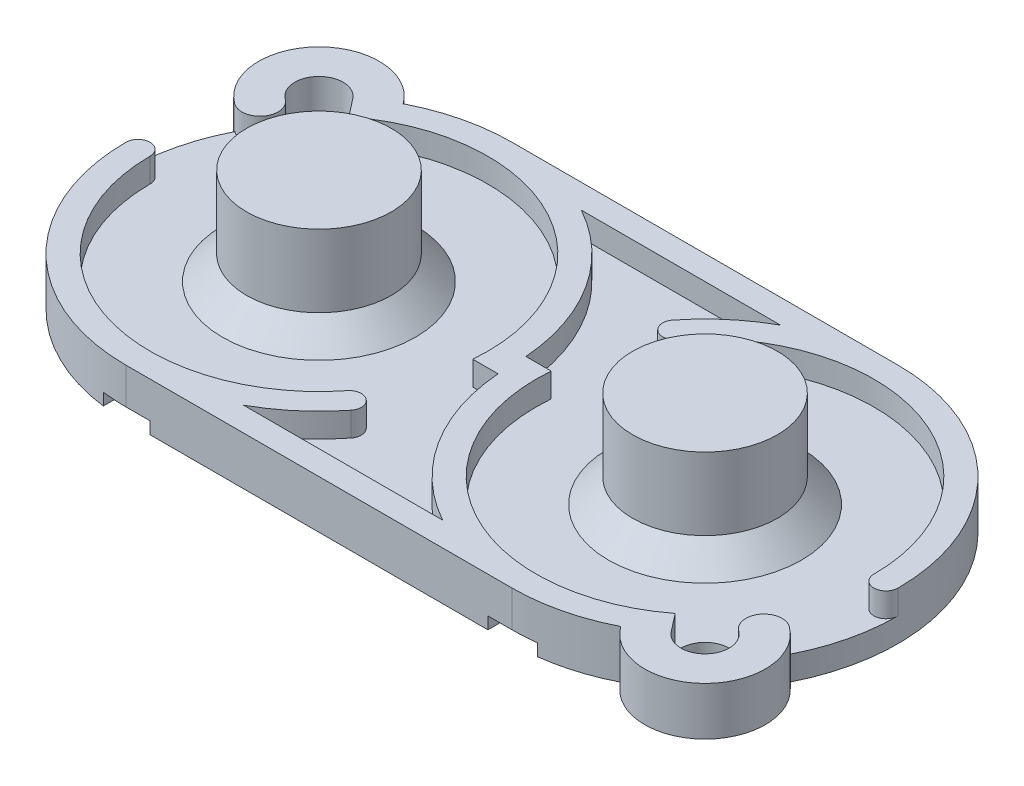
from build123d import *

# Parameters (mm, degrees)
SKETCH1_R            = 1
BASE_EXTRUDE_DEPTH   = 1
BOSS_EXTRUDE7_DEPTH  = 1
CIRPATTERN1_COUNT    = 2
BOSS_EXTRUDE8_DEPTH  = 1
SKETCH10_R           = 3
BOSS_EXTRUDE9_DEPTH  = 4
CHAMFER1_SIZE        = 1
CUT_EXTRUDE1_DEPTH   = 0.5
SKETCH14_R           = 2.5
BOSS_EXTRUDE10_DEPTH = 0.5


with BuildPart() as part:
    # Sketch1 → Base Extrude (new body)
    with BuildSketch(Plane(origin=(0, 0, 0), x_dir=(1, 0, 0), z_dir=(0, 1, 0))):
        with BuildLine():
            Line((0, 8), (16, 8))
            ThreePointArc((16, 8), (22.821901857, 4.178714521), (23.126695088, -3.634586238))
            ThreePointArc((23.126695088, -3.634586238), (23.424621202, -7.424621202), (19.634586238, -7.126695088))
            ThreePointArc((19.634586238, -7.126695088), (17.86901569, -7.778610438), (16, -8))
            Line((16, -8), (0, -8))
            ThreePointArc((0, -8), (-6.821901857, -4.178714521), (-7.126695088, 3.634586238))
            ThreePointArc((-7.126695088, 3.634586238), (-7.424621202, 7.424621202), (-3.634586238, 7.126695088))
            ThreePointArc((-3.634586238, 7.126695088), (-1.86901569, 7.778610438), (0, 8))
        make_face()
        with Locations(Location((-5.656854249, 5.656854249, 0), (0, 0, 270))):
            Circle(SKETCH1_R, mode=Mode.SUBTRACT)
        with Locations(Location((21.656854249, -5.656854249, 0), (0, 0, 270))):
            Circle(SKETCH1_R, mode=Mode.SUBTRACT)
    extrude(amount=BASE_EXTRUDE_DEPTH)

    # Sketch4 → Boss-Extrude7 (add)
    with BuildSketch(Plane(origin=(0, 1, 0), x_dir=(1, 0, 0), z_dir=(0, 1, 0))):
        with BuildLine():
            Line((-4.292206887, 5.529643754), (-4.866905142, 6.270026662))
            ThreePointArc((-4.866905142, 6.270026662), (-6.37503243, 6.352713503), (-6.244790585, 4.847947045))
            ThreePointArc((-6.244790585, 4.847947045), (-6.079062433, 3.80031439), (-7.126695088, 3.634586238))
            ThreePointArc((-7.126695088, 3.634586238), (-7.424621202, 7.424621202), (-3.634586238, 7.126695088))
            ThreePointArc((-3.634586238, 7.126695088), (-1.86901569, 7.778610438), (0, 8))
            ThreePointArc((0, 8), (5.656854249, 5.656854249), (8, 0))
            ThreePointArc((8, 0), (8.005634917, -0.300211458), (8.02253173, -0.6))
            Line((8.02253173, -0.6), (6.97423831, -0.6))
            ThreePointArc((6.97423831, -0.6), (3.3453634, 6.148865239), (-4.292206887, 5.529643754))
        make_face()
        with BuildLine():
            ThreePointArc((-7, 0), (-2.291287847, -6.614378278), (5.5, -4.330127019))
            ThreePointArc((5.5, -4.330127019), (6.20215193, -4.246564663), (6.285714286, -4.948716593))
            ThreePointArc((6.285714286, -4.948716593), (3.493584639, -7.196865038), (0, -8))
            ThreePointArc((0, -8), (-5.656854249, -5.656854249), (-8, 0))
            ThreePointArc((-8, 0), (-7.5, 0.5), (-7, 0))
        make_face()
    boss_extrude7 = extrude(amount=BOSS_EXTRUDE7_DEPTH)

    # CirPattern1: Boss-Extrude7 ×2 about axis
    cirpattern1_axis = Axis((8, 0, 0), (0, 1, 0))
    for i in range(1, CIRPATTERN1_COUNT):
        add(boss_extrude7.rotate(cirpattern1_axis, i * 360 / CIRPATTERN1_COUNT))

    # Sketch9 → Boss-Extrude8 (add)
    with BuildSketch(Plane(origin=(0, 1, 0), x_dir=(1, 0, 0), z_dir=(0, 1, 0))):
        with BuildLine():
            Line((12.127016654, 7), (3.872983346, 7))
            ThreePointArc((3.872983346, 7), (2, 7.745966692), (0, 8))
            Line((0, 8), (16, 8))
            ThreePointArc((16, 8), (14, 7.745966692), (12.127016654, 7))
        make_face()
        with BuildLine():
            Line((3.872983346, -7), (12.127016654, -7))
            ThreePointArc((12.127016654, -7), (14, -7.745966692), (16, -8))
            Line((16, -8), (0, -8))
            ThreePointArc((0, -8), (2, -7.745966692), (3.872983346, -7))
        make_face()
    extrude(amount=BOSS_EXTRUDE8_DEPTH)

    # Sketch10 → Boss-Extrude9 (add)
    with BuildSketch(Plane(origin=(0, 1, 0), x_dir=(1, 0, 0), z_dir=(0, 1, 0))):
        with Locations(Location((16, 0, 0), (0, 0, 270))):
            Circle(SKETCH10_R)
        with Locations(Location((0, 0, 0), (0, 0, 270))):
            Circle(SKETCH10_R)
    extrude(amount=BOSS_EXTRUDE9_DEPTH)

    # Chamfer1
    chamfer1_edges = [part.edges().sort_by_distance(p)[0] for p in [
        (16, 1, -3),
        (0, 1, -3),
    ]]
    chamfer(chamfer1_edges, length=CHAMFER1_SIZE)

    # Sketch12 → Back Cavity (revolve, cut)
    with BuildSketch(Plane.XY, mode=Mode.PRIVATE) as back_cavity_sk:
        Polygon((0, 1.75), (2.5, 1.75), (3.5, 0.5), (3.5, 0), (0, 0), align=None)
    back_cavity = revolve(back_cavity_sk.sketch.rotate(Axis((0, 3.203039839, 0), (0, -1, 0)), 90), axis=Axis((0, 3.203039839, 0), (0, -1, 0)), mode=Mode.SUBTRACT)

    # Mirror1: Back Cavity across plane
    add(back_cavity.mirror(Plane(origin=(8, 0, 0), x_dir=(0, 0, 1), z_dir=(1, 0, 0))), mode=Mode.SUBTRACT)

    # Sketch13 → Cut-Extrude1 (cut)
    with BuildSketch(Plane.XZ):
        with BuildLine():
            Line((3.354101966, 1), (12.645898034, 1))
            ThreePointArc((12.645898034, 1), (12.5, 0), (12.645898034, -1))
            Line((12.645898034, -1), (3.354101966, -1))
            ThreePointArc((3.354101966, -1), (3.5, 0), (3.354101966, 1))
        make_face()
        with BuildLine():
            Line((-1, 3.354101966), (-1, 7.937253933))
            ThreePointArc((-1, 7.937253933), (-0.5009833, 7.984298074), (0, 8))
            Line((0, 8), (1, 8))
            Line((1, 8), (1, 3.354101966))
            ThreePointArc((1, 3.354101966), (0, 3.5), (-1, 3.354101966))
        make_face()
        with BuildLine():
            Line((16, -8), (15, -8))
            Line((15, -8), (15, -3.354101966))
            ThreePointArc((15, -3.354101966), (16, -3.5), (17, -3.354101966))
            Line((17, -3.354101966), (17, -7.937253933))
            ThreePointArc((17, -7.937253933), (16.5009833, -7.984298074), (16, -8))
        make_face()
        with BuildLine():
            Line((-1, -3.354101966), (-1, -7.937253933))
            ThreePointArc((-1, -7.937253933), (-0.5009833, -7.984298074), (0, -8))
            Line((0, -8), (1, -8))
            Line((1, -8), (1, -3.354101966))
            ThreePointArc((1, -3.354101966), (0, -3.5), (-1, -3.354101966))
        make_face()
        with BuildLine():
            Line((15, 3.354101966), (15, 8))
            Line((15, 8), (16, 8))
            ThreePointArc((16, 8), (16.5009833, 7.984298074), (17, 7.937253933))
            Line((17, 7.937253933), (17, 3.354101966))
            ThreePointArc((17, 3.354101966), (16, 3.5), (15, 3.354101966))
        make_face()
    extrude(amount=-CUT_EXTRUDE1_DEPTH, mode=Mode.SUBTRACT)

    # Sketch14 → Boss-Extrude10 (add)
    with BuildSketch(Plane.XZ.offset(-1.75)):
        with Locations(Location((0, 0, 0), (0, 0, 270))):
            Circle(SKETCH14_R)
    boss_extrude10 = extrude(amount=BOSS_EXTRUDE10_DEPTH)

    # Mirror2: Boss-Extrude10 across plane
    add(boss_extrude10.mirror(Plane(origin=(8, 0, 0), x_dir=(0, 0, 1), z_dir=(1, 0, 0))))


solid = part.part
